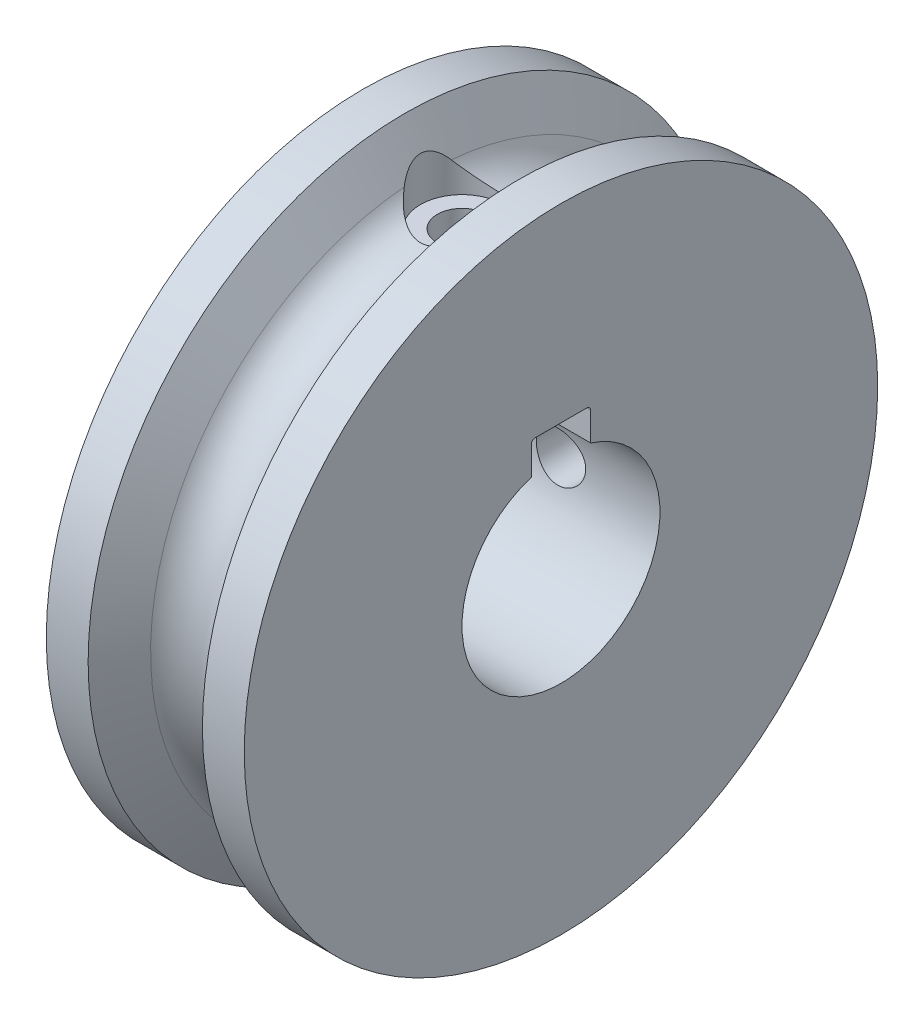
from build123d import *

# Parameters (mm, degrees)
SKETCH1_W           = 10
SKETCH1_H           = 11
SKETCH2_W           = 2.1
SKETCH2_H           = 3.6
TAPPED_HOLE1_REACH  = 38.29
TAPPED_HOLE1_BORE_R = 1.25
CIRPATTERN1_COUNT   = 2
CIRPATTERN1_ANGLE   = 90
CUT_EXTRUDE1_DEPTH  = 25.738633924


with BuildPart() as part:
    # Sketch1 → Revolve1 (revolve)
    with BuildSketch(Plane.XY, mode=Mode.PRIVATE) as revolve1_sk:
        with Locations((5, 10.5)):
            Rectangle(SKETCH1_W, SKETCH1_H)
    revolve(revolve1_sk.sketch.rotate(Axis((0, 0, 0), (1, 0, 0)), 180), axis=Axis((0, 0, 0), (1, 0, 0)))

    # Sketch2 → Cut-Revolve1 (revolve, cut)
    with BuildSketch(Plane.XY, mode=Mode.PRIVATE) as cut_revolve1_sk:
        with Locations((6.05, 14.2)):
            Rectangle(SKETCH2_W, SKETCH2_H)
    cut_revolve1 = revolve(cut_revolve1_sk.sketch.rotate(Axis((5, 16, 0), (0, -1, 0)), 180), axis=Axis((5, 16, 0), (0, -1, 0)), mode=Mode.SUBTRACT)

    # Tapped Hole1 bore → Tapped Hole1 (cut, up to next)
    with BuildSketch(Plane(origin=(0, 15, 0), x_dir=(1, 0, 0), z_dir=(0, 1, 0)), mode=Mode.PRIVATE) as tapped_hole1_sk1:
        with Locations((5, 0)):
            Circle(TAPPED_HOLE1_BORE_R)
    tapped_hole1_tool1 = extrude(tapped_hole1_sk1.sketch, amount=-TAPPED_HOLE1_REACH, mode=Mode.PRIVATE) & part.part
    tapped_hole1 = tapped_hole1_tool1.solids().sort_by_distance((5, 15, 0))[0]
    add(tapped_hole1, mode=Mode.SUBTRACT)

    # CirPattern1: Cut-Revolve1, Tapped Hole1 ×2 about axis
    cirpattern1_axis = Axis((0, 0, 0), (-1, 0, 0))
    add([cut_revolve1.rotate(cirpattern1_axis, i * CIRPATTERN1_ANGLE / (CIRPATTERN1_COUNT - 1)) for i in range(1, CIRPATTERN1_COUNT)], mode=Mode.SUBTRACT)
    add([tapped_hole1.rotate(cirpattern1_axis, i * CIRPATTERN1_ANGLE / (CIRPATTERN1_COUNT - 1)) for i in range(1, CIRPATTERN1_COUNT)], mode=Mode.SUBTRACT)

    # Sketch5 → Cut-Extrude1 (cut, through all)
    with BuildSketch(Plane(origin=(0, 0, 0), x_dir=(0, 0, -1), z_dir=(1, 0, 0))):
        with BuildLine():
            Line((-1.5, 0), (1.5, 0))
            Line((1.5, 0), (1.5, 6.2))
            ThreePointArc((1.5, 6.2), (1.441421356, 6.341421356), (1.3, 6.4))
            Line((1.3, 6.4), (-1.3, 6.4))
            ThreePointArc((-1.3, 6.4), (-1.441421356, 6.341421356), (-1.5, 6.2))
            Line((-1.5, 6.2), (-1.5, 0))
        make_face()
    extrude(amount=CUT_EXTRUDE1_DEPTH, mode=Mode.SUBTRACT)

    # Sketch7 → Cut-Revolve3 (revolve, cut)
    with BuildSketch(Plane.XY, mode=Mode.PRIVATE) as cut_revolve3_sk:
        with BuildLine():
            Line((2.113248654, 16), (3.267949192, 14))
            ThreePointArc((3.267949192, 14), (5, 13), (6.732050808, 14))
            Line((6.732050808, 14), (7.886751346, 16))
            Line((7.886751346, 16), (2.113248654, 16))
        make_face()
    revolve(cut_revolve3_sk.sketch.rotate(Axis((0, 0, 0), (1, 0, 0)), 180), axis=Axis((0, 0, 0), (1, 0, 0)), mode=Mode.SUBTRACT)


solid = part.part
